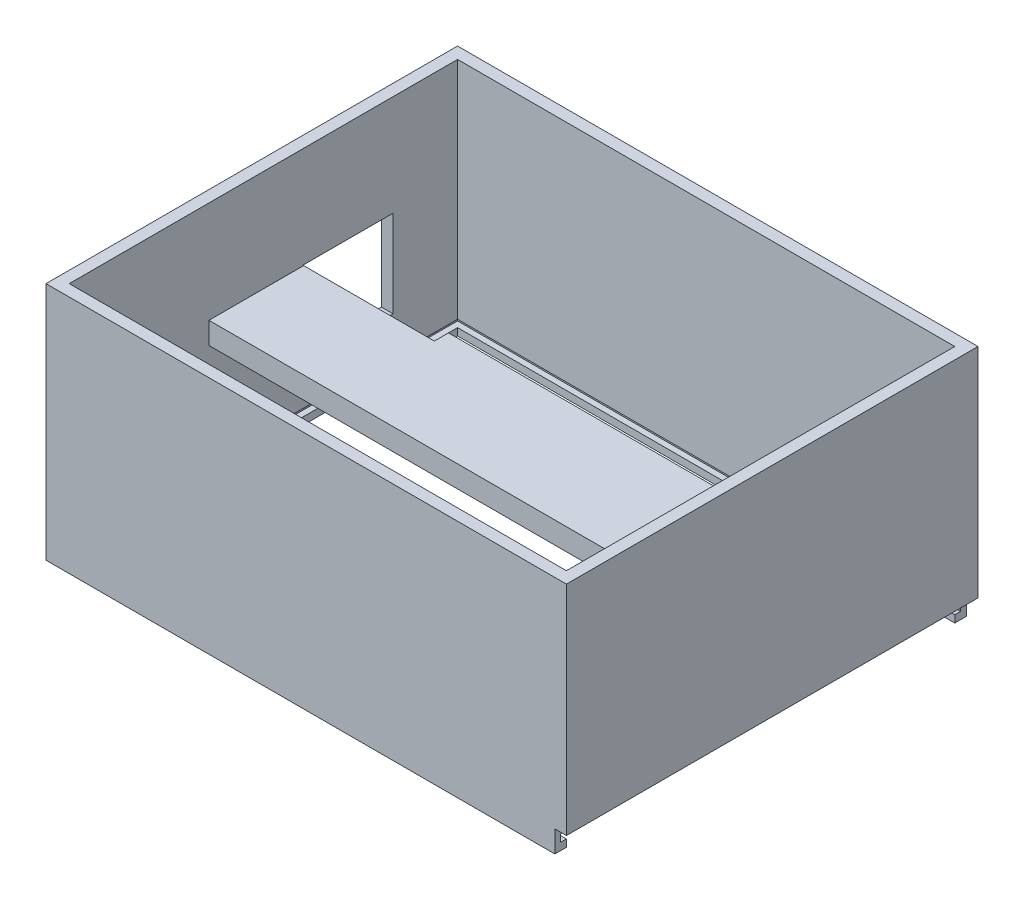
from build123d import *

# Parameters (mm, degrees)
SKETCH1_W           = 71.7
SKETCH1_H           = 56.7
SKETCH1_W_2         = 68.5
SKETCH1_H_2         = 53.5
BOSS_EXTRUDE1_DEPTH = 30
SKETCH2_W           = 15
SKETCH2_H           = 3
BOSS_EXTRUDE2_DEPTH = 70
SKETCH3_W           = 12.3
SKETCH3_H           = 12
SKETCH3_W_2         = 9.3
SKETCH3_H_2         = 11
CUT_EXTRUDE1_DEPTH  = 1.6
SKETCH3_2_W         = 12.3
SKETCH3_2_H         = 12
SKETCH3_2_W_2       = 9.3
SKETCH3_2_H_2       = 11
CUT_EXTRUDE2_DEPTH  = 18
BOSS_EXTRUDE3_DEPTH = 3
SKETCH5_W           = 55.1
SKETCH5_H           = 1
CUT_EXTRUDE3_DEPTH  = 69.3


with BuildPart() as part:
    # Sketch1 → Boss-Extrude1 (new body)
    with BuildSketch(Plane(origin=(0, 0, 0), x_dir=(1, 0, 0), z_dir=(0, 1, 0))):
        with Locations((1.229030624, -8.245503616)):
            Rectangle(SKETCH1_W, SKETCH1_H)
        with Locations((1.229030624, -8.245503616)):
            Rectangle(SKETCH1_W_2, SKETCH1_H_2, mode=Mode.SUBTRACT)
    extrude(amount=BOSS_EXTRUDE1_DEPTH)

    # Sketch2 → Boss-Extrude2 (add)
    with BuildSketch(Plane(origin=(-33.020969376, 0, 0), x_dir=(0, 0, -1), z_dir=(1, 0, 0))):
        with Locations((-8.245503616, 14.5)):
            Rectangle(SKETCH2_W, SKETCH2_H)
    extrude(amount=BOSS_EXTRUDE2_DEPTH)

    # Sketch3 → Cut-Extrude1 (cut)
    with BuildSketch(Plane(origin=(-33.020969376, 0, 0), x_dir=(0, 0, -1), z_dir=(1, 0, 0))):
        with Locations((3.454496384, 10.1)):
            Rectangle(SKETCH3_W, SKETCH3_H)
        with Locations((-27.145503616, 9.6)):
            Rectangle(SKETCH3_W_2, SKETCH3_H_2)
    extrude(amount=-CUT_EXTRUDE1_DEPTH, mode=Mode.SUBTRACT)

    # Sketch3<2> → Cut-Extrude2 (cut)
    with BuildSketch(Plane(origin=(-33.020969376, 0, 0), x_dir=(0, 0, -1), z_dir=(1, 0, 0))):
        with Locations((3.454496384, 10.1)):
            Rectangle(SKETCH3_2_W, SKETCH3_2_H)
        with Locations((-27.145503616, 9.6)):
            Rectangle(SKETCH3_2_W_2, SKETCH3_2_H_2)
    extrude(amount=CUT_EXTRUDE2_DEPTH, mode=Mode.SUBTRACT)

    # Sketch4 → Boss-Extrude3 (add)
    with BuildSketch(Plane.XZ):
        Polygon((35.479030624, 36.595503616), (35.479030624, 34.995503616), (-33.020969376, 34.995503616), (-33.020969376, -18.504496384), (35.479030624, -18.504496384), (35.479030624, -20.104496384), (-34.620969376, -20.104496384), (-34.620969376, 36.595503616), align=None)
    extrude(amount=BOSS_EXTRUDE3_DEPTH)

    # Sketch5 → Cut-Extrude3 (cut)
    with BuildSketch(Plane(origin=(35.479030624, 0, 0), x_dir=(0, 0, -1), z_dir=(1, 0, 0))):
        with Locations((-8.245503616, -1.5)):
            Rectangle(SKETCH5_W, SKETCH5_H)
    extrude(amount=-CUT_EXTRUDE3_DEPTH, mode=Mode.SUBTRACT)


solid = part.part
